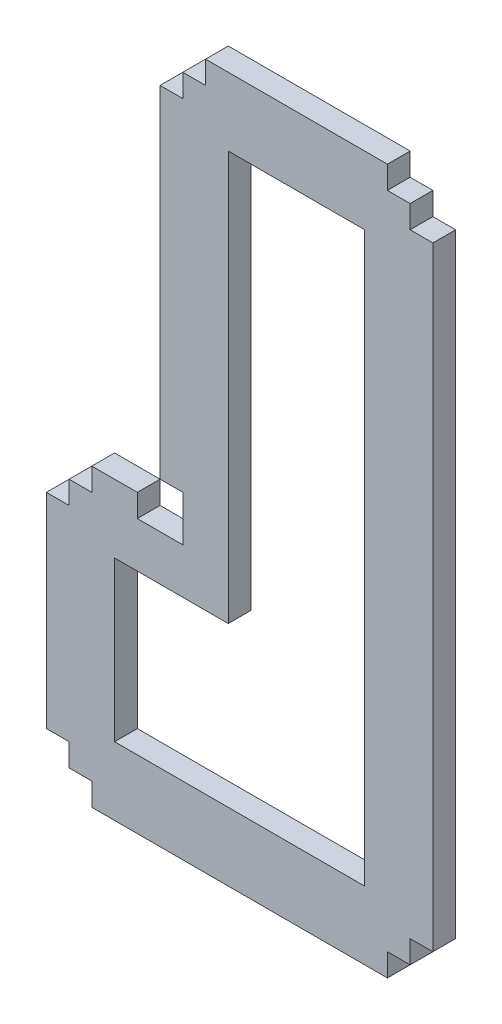
from build123d import *

# Parameters (mm, degrees)
BOSS_EXTRUDE1_START = -3.175
BOSS_EXTRUDE1_DEPTH = 6.35
CUT_EXTRUDE1_DEPTH  = 167.316670842


with BuildPart() as part:
    # Sketch1 → Boss-Extrude1 (new body)
    with BuildSketch(Plane.XY.offset(BOSS_EXTRUDE1_START)):
        Polygon((12.7, -69.85), (19.05, -69.85), (19.05, -76.2), (101.6, -76.2), (101.6, -69.85), (107.95, -69.85), (107.95, -63.5), (114.3, -63.5), (114.3, 107.95), (107.95, 107.95), (107.95, 114.3), (101.6, 114.3), (101.6, 120.65), (50.8, 120.65), (50.8, 114.3), (44.45, 114.3), (44.45, 107.95), (38.1, 107.95), (38.1, 12.7), (44.45, 12.7), (44.45, 0), (31.75, 0), (31.75, 6.35), (19.05, 6.35), (19.05, 0), (12.7, 0), (12.7, -6.35), (6.35, -6.35), (6.35, -63.5), (12.7, -63.5), align=None)
    extrude(amount=-BOSS_EXTRUDE1_DEPTH)

    # Sketch2 → Cut-Extrude1 (cut, through all)
    with BuildSketch(Plane.XY.offset(-3.175)):
        Polygon((25.4, -57.15), (95.25, -57.15), (95.25, 101.6), (57.15, 101.6), (57.15, -12.7), (25.4, -12.7), align=None)
    extrude(amount=-CUT_EXTRUDE1_DEPTH, mode=Mode.SUBTRACT)


solid = part.part
